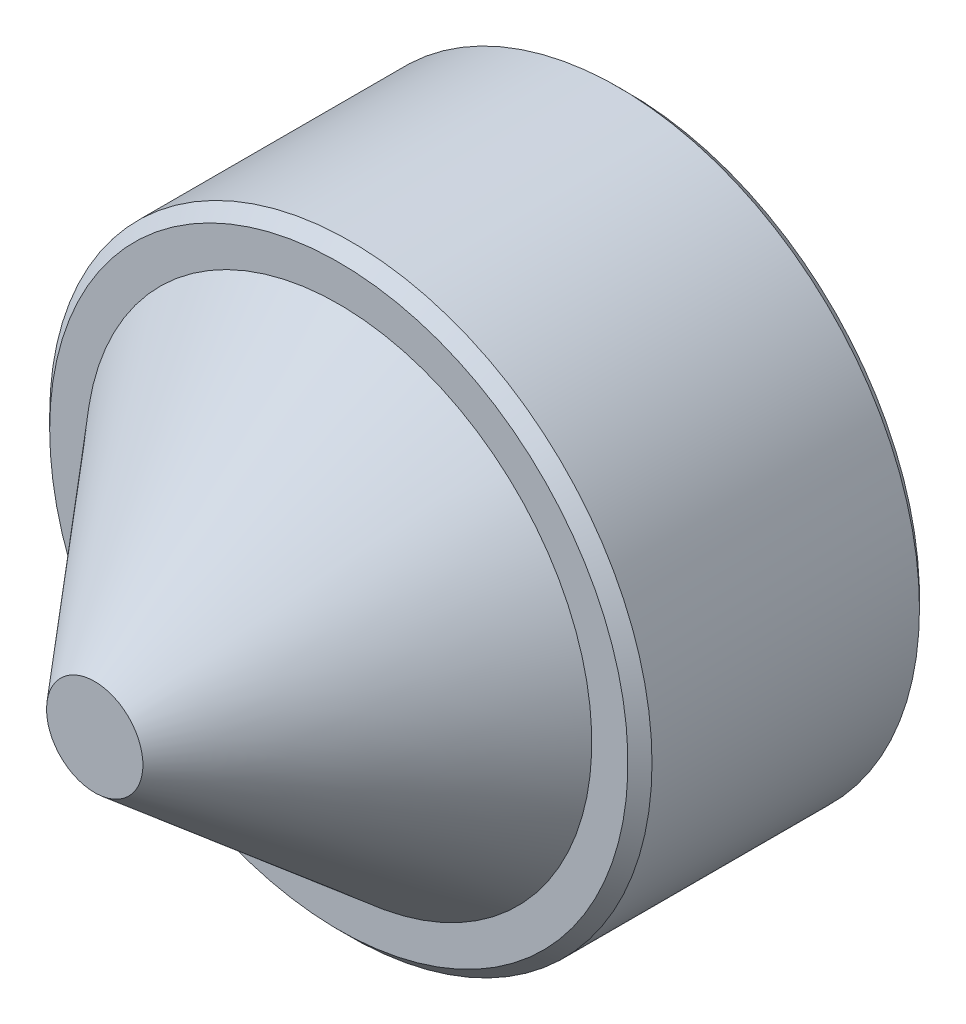
from build123d import *


with BuildPart() as part:
    # body_sketch → body (revolve)
    with BuildSketch(Plane(origin=(0, 0, 0), x_dir=(1, 0, 0), z_dir=(0, 1, 0)), mode=Mode.PRIVATE) as body_sk:
        Polygon((0, 0), (12.1, 0), (12.5, -0.4), (12.5, -11.5), (12, -12), (10.5, -12), (2, -22.13), (0, -22.13), align=None)
    revolve(body_sk.sketch.rotate(Axis((0, 0, 0), (0, 0, 1)), 180), axis=Axis((0, 0, 0), (0, 0, 1)))

    # socket_sketch → socket (revolve, cut)
    with BuildSketch(Plane(origin=(0, 0, 0), x_dir=(1, 0, 0), z_dir=(0, 1, 0)), mode=Mode.PRIVATE) as socket_sk:
        Polygon((0, 0.5), (11.419545903, 0.5), (2.080454097, -10.63), (0, -10.63), align=None)
    revolve(socket_sk.sketch.rotate(Axis((0, 0, 0), (0, 0, 1)), 180), axis=Axis((0, 0, 0), (0, 0, 1)), mode=Mode.SUBTRACT)


solid = part.part
